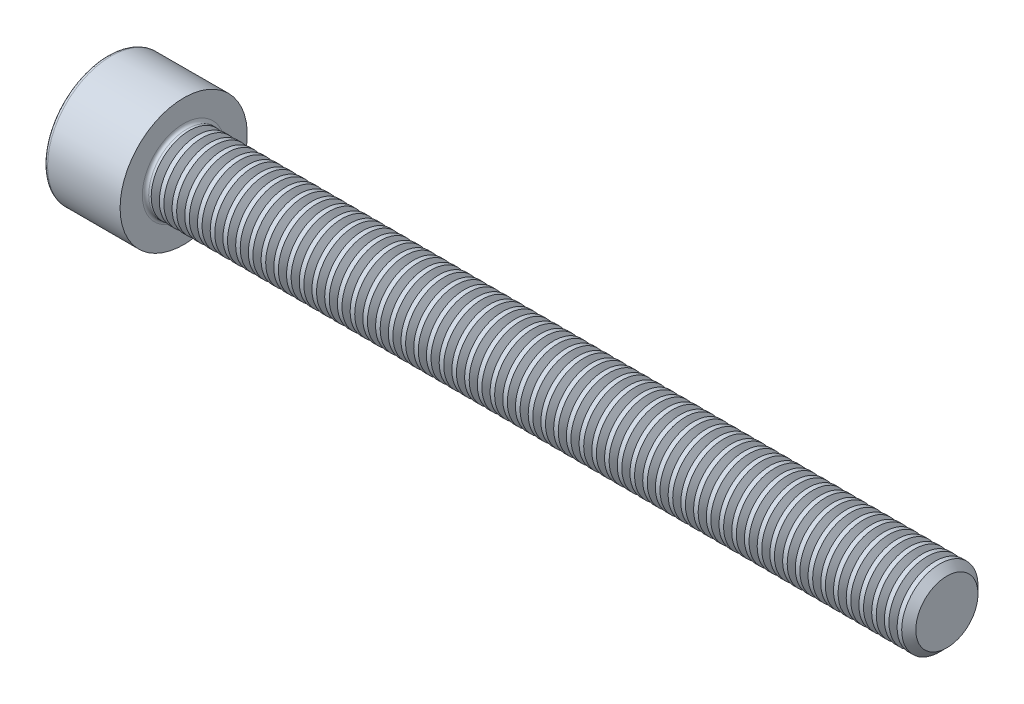
from build123d import *

# Parameters (mm, degrees)
FILLET1_R       = 0.25
FILLET2_R       = 0.3
HEX_2_DEPTH     = 3
THDSCHPAT_COUNT = 59
THDSCHPAT_PITCH = 1


with BuildPart() as part:
    # BodySke → BaseBody (revolve)
    with BuildSketch(Plane.XY, mode=Mode.PRIVATE) as basebody_sk:
        Polygon((0, 0), (0, 5), (6, 5), (6, 3), (65.4455, 3), (66, 2.4455), (66, 0), align=None)
    revolve(basebody_sk.sketch.rotate(Axis((0, 0, 0), (1, 0, 0)), 90), axis=Axis((0, 0, 0), (1, 0, 0)))

    # Fillet1
    fillet1_edges = [part.edges().sort_by_distance(p)[0] for p in [
        (6, 0, -3),
    ]]
    fillet(fillet1_edges, radius=FILLET1_R)

    # Fillet2
    fillet2_edges = [part.edges().sort_by_distance(p)[0] for p in [
        (0, 0, -5),
    ]]
    fillet(fillet2_edges, radius=FILLET2_R)

    # HexSke → Hex 2 (cut)
    with BuildSketch(Plane(origin=(0, 0, 0), x_dir=(0, 0, -1), z_dir=(1, 0, 0))):
        Polygon((0, 2.886751346), (-2.5, 1.443375673), (-2.5, -1.443375673), (0, -2.886751346), (2.5, -1.443375673), (2.5, 1.443375673), align=None)
    extrude(amount=HEX_2_DEPTH, mode=Mode.SUBTRACT)

    # Hex-PreBroachSke → Hex-PreBroach (revolve, cut)
    with BuildSketch(Plane.XY, mode=Mode.PRIVATE) as hex_prebroach_sk:
        Polygon((0, 0), (0, 2.5), (3, 2.5), (4.443375673, 0), align=None)
    revolve(hex_prebroach_sk.sketch.rotate(Axis((0, 0, 0), (1, 0, 0)), 270), axis=Axis((0, 0, 0), (1, 0, 0)), mode=Mode.SUBTRACT)

    # ThdSchSke → ThreadSchematic (revolve, cut)
    with BuildSketch(Plane.XY, mode=Mode.PRIVATE) as threadschematic_sk:
        Polygon((64.4455, 3.640281449), (64.4455, 3), (64.765640724, 2.4455), (65.085781449, 3), (65.085781449, 3.640281449), align=None)
    threadschematic = revolve(threadschematic_sk.sketch.rotate(Axis((0, 0, 0), (1, 0, 0)), 90), axis=Axis((0, 0, 0), (1, 0, 0)), mode=Mode.SUBTRACT)

    # ThdSchPat: ThreadSchematic ×59
    with Locations(*[(-i * THDSCHPAT_PITCH, 0, 0) for i in range(1, THDSCHPAT_COUNT)]):
        add(threadschematic, mode=Mode.SUBTRACT)


solid = part.part
